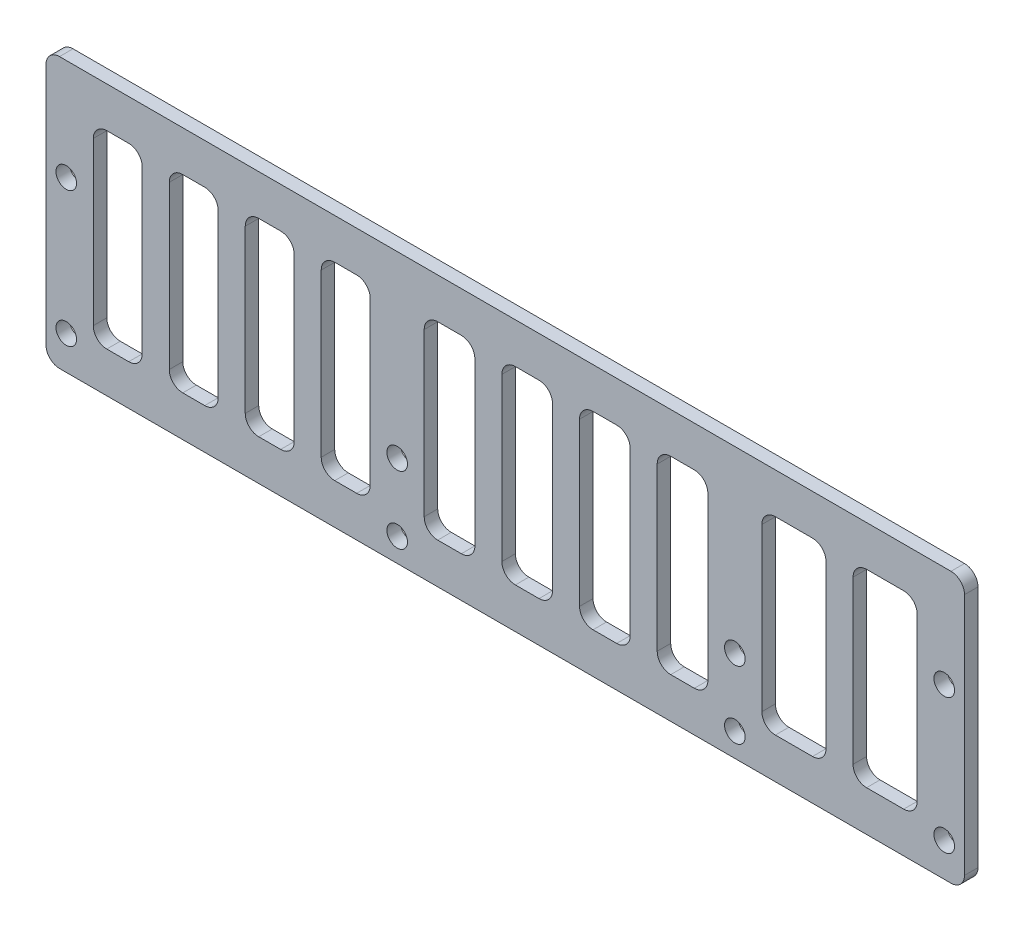
from build123d import *

# Parameters (mm, degrees)
SKETCH_1_W          = 136
SKETCH_1_H          = 40
EXTRUDE_1_DEPTH     = 2
SKETCH_2_R          = 1.525
CUT_EXTRUDE_1_DEPTH = 2
SKETCH_3_R          = 1.525
CUT_EXTRUDE_2_DEPTH = 22
SKETCH_4_W          = 18.5
SKETCH_4_H          = 28
CUT_EXTRUDE_3_DEPTH = 22
EXTRUDE_2_DEPTH     = 2
SKETCH_6_W          = 9.5
SKETCH_6_H          = 28
CUT_EXTRUDE_4_DEPTH = 2
FILLET_1_R          = 2
SKETCH_7_W          = 19
SKETCH_7_H          = 28
CUT_EXTRUDE_5_DEPTH = 2
EXTRUDE_3_DEPTH     = 2
FILLET_2_R          = 2
FILLET_3_R          = 2


with BuildPart() as part:
    # 草图1 → 凸台-拉伸1 (new body)
    with BuildSketch(Plane.XY):
        Rectangle(SKETCH_1_W, SKETCH_1_H)
    extrude(amount=EXTRUDE_1_DEPTH)

    # 草图2 → 切除-拉伸1 (cut)
    with BuildSketch(Plane(origin=(0, 0, 0), x_dir=(-1, 0, 0), z_dir=(0, 0, -1))):
        with Locations((-34, -6.5)):
            Circle(SKETCH_2_R)
        with Locations((-34, -16.5)):
            Circle(SKETCH_2_R)
        with Locations((16, -6.5)):
            Circle(SKETCH_2_R)
        with Locations((16, -16.5)):
            Circle(SKETCH_2_R)
    extrude(amount=-CUT_EXTRUDE_1_DEPTH, mode=Mode.SUBTRACT)

    # 草图3 → 切除-拉伸2 (cut)
    with BuildSketch(Plane(origin=(0, 0, 0), x_dir=(-1, 0, 0), z_dir=(0, 0, -1))):
        with Locations((65, -15)):
            Circle(SKETCH_3_R)
        with Locations((65, 5)):
            Circle(SKETCH_3_R)
        with Locations((-65, 5)):
            Circle(SKETCH_3_R)
        with Locations((-65, -15)):
            Circle(SKETCH_3_R)
    extrude(amount=-CUT_EXTRUDE_2_DEPTH, mode=Mode.SUBTRACT)

    # 草图4 → 切除-拉伸3 (cut)
    with BuildSketch(Plane.XY.offset(2)):
        with Locations((-51.75, 0)):
            Rectangle(SKETCH_4_W, SKETCH_4_H)
        with Locations((-29.25, 0)):
            Rectangle(SKETCH_4_W, SKETCH_4_H)
    extrude(amount=-CUT_EXTRUDE_3_DEPTH, mode=Mode.SUBTRACT)

    # 草图5 → 凸台-拉伸2 (add)
    with BuildSketch(Plane.XY.offset(2)):
        with BuildLine():
            Line((-53.75, 14), (-53.75, -14))
            ThreePointArc((-53.75, -14), (-51.75, -16), (-49.75, -14))
            Line((-49.75, -14), (-49.75, 14))
            ThreePointArc((-49.75, 14), (-51.75, 16), (-53.75, 14))
        make_face()
        with BuildLine():
            Line((-31.25, 14), (-31.25, -14))
            ThreePointArc((-31.25, -14), (-29.25, -16), (-27.25, -14))
            Line((-27.25, -14), (-27.25, 14))
            ThreePointArc((-27.25, 14), (-29.25, 16), (-31.25, 14))
        make_face()
    extrude(amount=-EXTRUDE_2_DEPTH)

    # 草图6 → 切除-拉伸4 (cut)
    with BuildSketch(Plane.XY.offset(2)):
        with Locations((42.75, 0)):
            Rectangle(SKETCH_6_W, SKETCH_6_H)
        with Locations((56.25, 0)):
            Rectangle(SKETCH_6_W, SKETCH_6_H)
    extrude(amount=-CUT_EXTRUDE_4_DEPTH, mode=Mode.SUBTRACT)

    # 圆角1
    fillet_1_edges = [part.edges().sort_by_distance(p)[0] for p in [
        (-53.75, -14, 1),
        (-49.75, -14, 1),
        (-49.75, 14, 1),
        (-53.75, 14, 1),
        (-31.25, -14, 1),
        (-27.25, -14, 1),
        (-27.25, 14, 1),
        (-31.25, 14, 1),
        (47.5, 14, 1),
        (47.5, -14, 1),
        (38, -14, 1),
        (38, 14, 1),
        (51.5, -14, 1),
        (61, -14, 1),
        (61, 14, 1),
        (51.5, 14, 1),
        (-42.5, 14, 1),
        (-42.5, -14, 1),
        (-61, -14, 1),
        (-61, 14, 1),
        (-38.5, 14, 1),
        (-20, 14, 1),
        (-20, -14, 1),
        (-38.5, -14, 1),
    ]]
    fillet(fillet_1_edges, radius=FILLET_1_R)

    # 草图7 → 切除-拉伸5 (cut)
    with BuildSketch(Plane.XY.offset(2)):
        with Locations((-2.5, 0)):
            Rectangle(SKETCH_7_W, SKETCH_7_H)
        with Locations((20.5, 0)):
            Rectangle(SKETCH_7_W, SKETCH_7_H)
    extrude(amount=-CUT_EXTRUDE_5_DEPTH, mode=Mode.SUBTRACT)

    # 草图8 → 凸台-拉伸3 (add)
    with BuildSketch(Plane.XY.offset(2)):
        with BuildLine():
            Line((-4.5, 14), (-4.5, -14))
            ThreePointArc((-4.5, -14), (-2.5, -16), (-0.5, -14))
            Line((-0.5, -14), (-0.5, 14))
            ThreePointArc((-0.5, 14), (-2.5, 16), (-4.5, 14))
        make_face()
        with BuildLine():
            Line((18.5, 14), (18.5, -14))
            ThreePointArc((18.5, -14), (20.5, -16), (22.5, -14))
            Line((22.5, -14), (22.5, 14))
            ThreePointArc((22.5, 14), (20.5, 16), (18.5, 14))
        make_face()
    extrude(amount=-EXTRUDE_3_DEPTH)

    # 圆角2
    fillet_2_edges = [part.edges().sort_by_distance(p)[0] for p in [
        (7, 14, 1),
        (7, -14, 1),
        (-12, -14, 1),
        (-12, 14, 1),
        (11, -14, 1),
        (30, -14, 1),
        (30, 14, 1),
        (11, 14, 1),
        (-4.5, -14, 1),
        (-0.5, -14, 1),
        (-0.5, 14, 1),
        (-4.5, 14, 1),
        (18.5, -14, 1),
        (22.5, -14, 1),
        (22.5, 14, 1),
        (18.5, 14, 1),
    ]]
    fillet(fillet_2_edges, radius=FILLET_2_R)

    # 圆角3
    fillet_3_edges = [part.edges().sort_by_distance(p)[0] for p in [
        (68, -20, 1),
        (-68, -20, 1),
        (-68, 20, 1),
        (68, 20, 1),
    ]]
    fillet(fillet_3_edges, radius=FILLET_3_R)


solid = part.part
